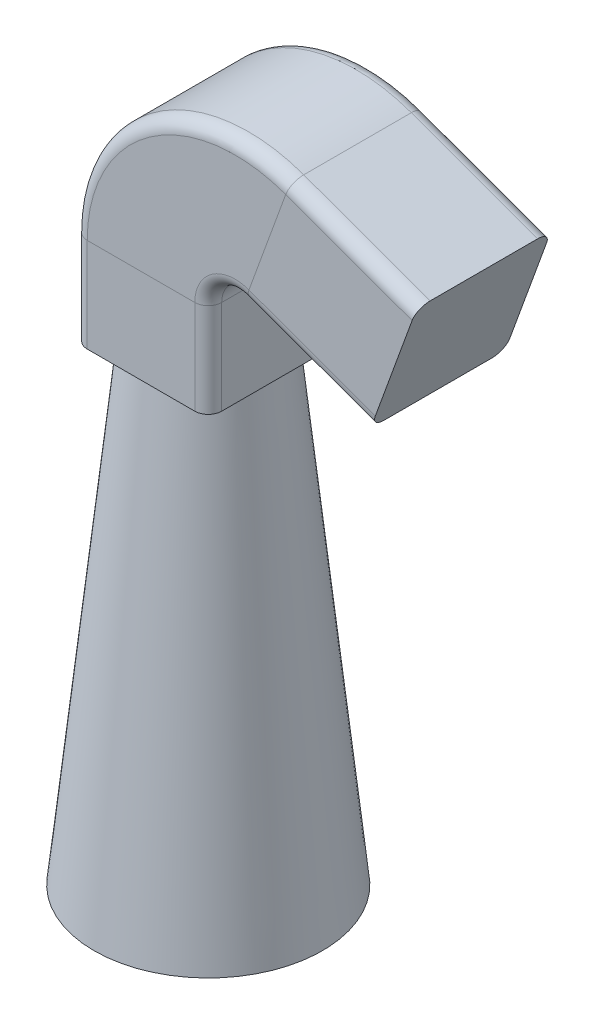
from build123d import *

# Parameters (mm, degrees)
SKETCH4_W = 10
SKETCH4_H = 10
FILLET1_R = 1
FILLET2_R = 1


with BuildPart() as part:
    # Sketch1 → Revolve1 (revolve)
    with BuildSketch(Plane(origin=(0, 0, 0), x_dir=(0, 0, -1), z_dir=(1, 0, 0)), mode=Mode.PRIVATE) as revolve1_sk:
        Polygon((0, 0), (8.5, 0), (4.821351766, 35), (0, 35), align=None)
    revolve(revolve1_sk.sketch.rotate(Axis((0, 13.119565217, 0), (0, -1, 0)), 180), axis=Axis((0, 13.119565217, 0), (0, -1, 0)))

    # Sweep1: sweep along a path in Sketch2
    with BuildLine(Plane.XY) as sweep1_path:
        Line((0, 35), (0, 42.002963953))
        ThreePointArc((0, 42.002963953), (2.984964946, 47.737028263), (9.394141003, 48.580812298))
        Line((9.394141003, 48.580812298), (18.793852416, 45.159597133))
    # Sketch4 → Sweep1 (sweep)
    with BuildSketch(Plane(origin=(2.081374564, -0.757558388, 0), x_dir=(0.3420201433256729, 0.9396926207859069, 0), z_dir=(0.9396926207859069, -0.3420201433256729, 0))):
        with Locations((48.864016281, 0)):
            Rectangle(SKETCH4_W, SKETCH4_H)
    sweep(path=sweep1_path.line)

    # Fillet1
    fillet1_edges = [part.edges().sort_by_distance(p)[0] for p in [
        (-5, 38.501481976, -5),
        (-5, 38.501481976, 5),
        (0.117082764, 51.832788484, -5),
        (0.117082764, 51.832788484, 5),
        (15.804097426, 51.56866782, -5),
        (15.804097426, 51.56866782, 5),
    ]]
    fillet(fillet1_edges, radius=FILLET1_R)

    # Fillet2
    fillet2_edges = [part.edges().sort_by_distance(p)[0] for p in [
        (5, 38.501481976, -5),
        (5, 38.501481976, 5),
        (5.852847127, 43.641268041, -5),
        (5.852847127, 43.641268041, 5),
        (12.383895993, 42.171741612, -5),
        (12.383895993, 42.171741612, 5),
    ]]
    fillet(fillet2_edges, radius=FILLET2_R)


solid = part.part
